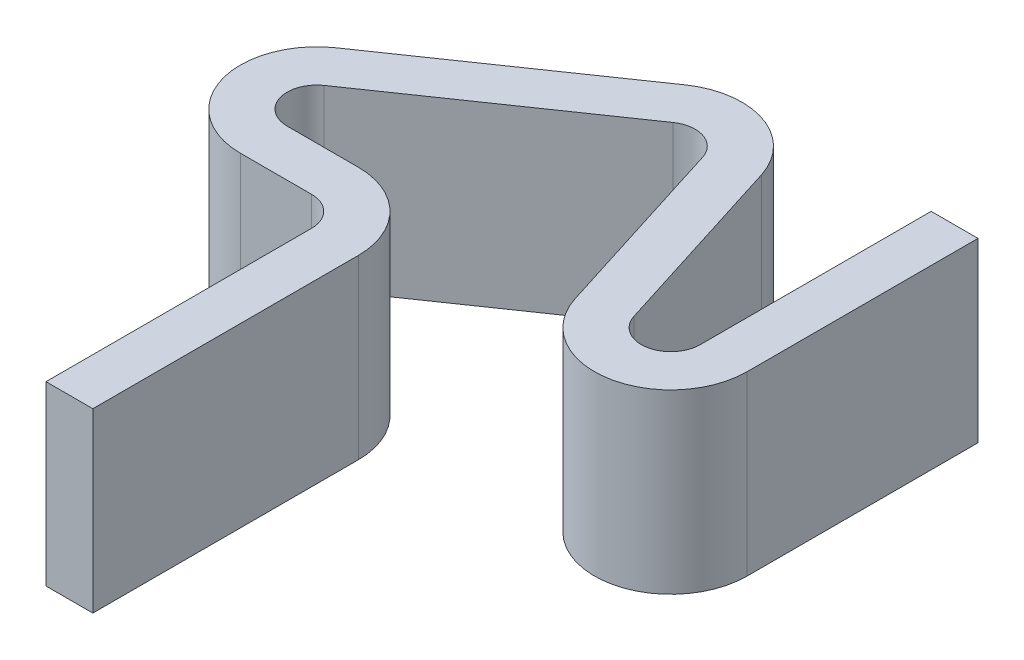
from build123d import *

# Parameters (mm, degrees)
BOSS_EXTRUDE1_DEPTH = 1.5


with BuildPart() as part:
    # Sketch1 → Boss-Extrude1 (new, symmetric)
    with BuildSketch(Plane(origin=(0, 0, 0), x_dir=(1, 0, 0), z_dir=(0, 1, 0))):
        with BuildLine():
            Line((1.29375, 0), (1.29375, -4.5))
            Line((1.29375, -4.5), (0.5, -4.5))
            Line((0.5, -4.5), (0.5, 0))
            ThreePointArc((0.5, 0), (0.353553391, 0.353553391), (0, 0.5))
            Line((0, 0.5), (-1.20625, 0.5))
            ThreePointArc((-1.20625, 0.5), (-2.441545823, 1.409259047), (-1.940487786, 2.858965441))
            Line((-1.940487786, 2.858965441), (1.559512214, 5.271465441))
            ThreePointArc((1.559512214, 5.271465441), (2.714013578, 5.429837997), (3.52755254, 4.595506155))
            Line((3.52755254, 4.595506155), (4.524019527, 1.437062839))
            ThreePointArc((4.524019527, 1.437062839), (5.076956782, 1.093325967), (5.500851427, 1.5875))
            Line((5.500851427, 1.5875), (5.500851427, 5.5))
            Line((5.500851427, 5.5), (6.294601427, 5.5))
            Line((6.294601427, 5.5), (6.294601427, 1.5875))
            ThreePointArc((6.294601427, 1.5875), (5.197774033, 0.30882469), (3.767048886, 1.198243845))
            Line((3.767048886, 1.198243845), (2.7705819, 4.356687161))
            ThreePointArc((2.7705819, 4.356687161), (2.456170707, 4.67913425), (2.009986604, 4.617927465))
            Line((2.009986604, 4.617927465), (-1.490013396, 2.205427465))
            ThreePointArc((-1.490013396, 2.205427465), (-1.683659014, 1.645154463), (-1.20625, 1.29375))
            Line((-1.20625, 1.29375), (0, 1.29375))
            ThreePointArc((0, 1.29375), (0.914819398, 0.914819398), (1.29375, 0))
        make_face()
    extrude(amount=BOSS_EXTRUDE1_DEPTH, both=True)


solid = part.part
